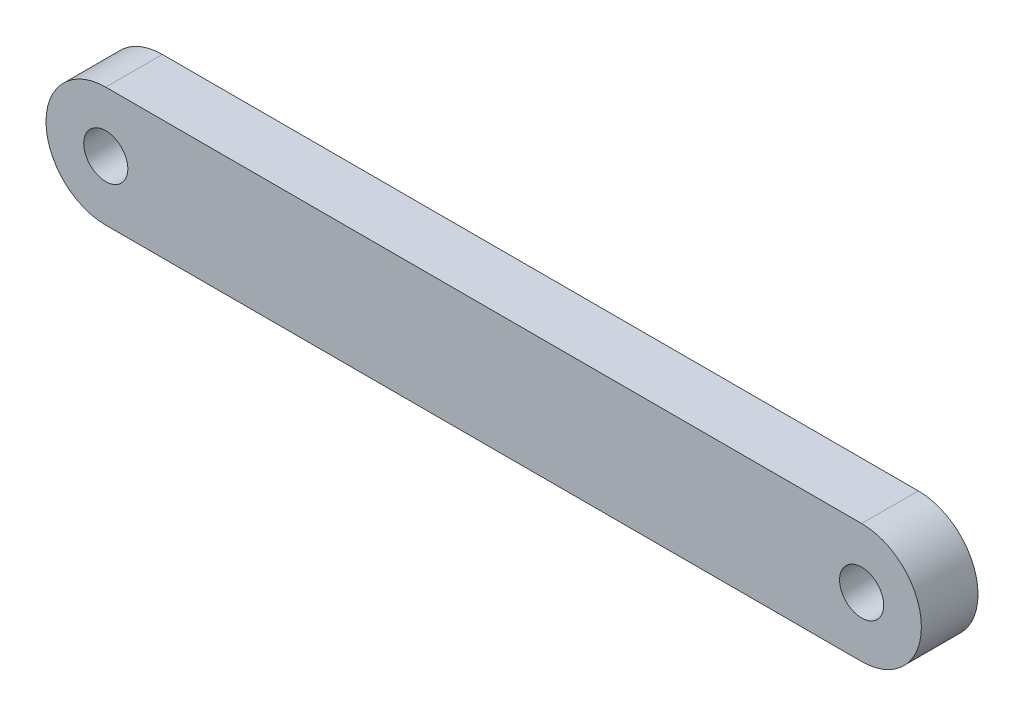
from build123d import *

# Parameters (mm, degrees)
SKETCH2_R           = 1.75
BOSS_EXTRUDE1_DEPTH = 4.4958


with BuildPart() as part:
    # Sketch2 → Boss-Extrude1 (new body)
    with BuildSketch(Plane(origin=(0, 0, 0), x_dir=(-1, 0, 0), z_dir=(0, 0, -1))):
        with BuildLine():
            Line((-30.011103704, 54.674553391), (30.011103704, 54.674553391))
            ThreePointArc((30.011103704, 54.674553391), (34.757207408, 49.928449687), (30.011103704, 45.182345983))
            Line((30.011103704, 45.182345983), (-30.011103704, 45.182345983))
            ThreePointArc((-30.011103704, 45.182345983), (-34.757207408, 49.928449687), (-30.011103704, 54.674553391))
        make_face()
        with Locations((-30.011103704, 49.928449687)):
            Circle(SKETCH2_R, mode=Mode.SUBTRACT)
        with Locations((30.011103704, 49.928449687)):
            Circle(SKETCH2_R, mode=Mode.SUBTRACT)
    extrude(amount=BOSS_EXTRUDE1_DEPTH)


solid = part.part
